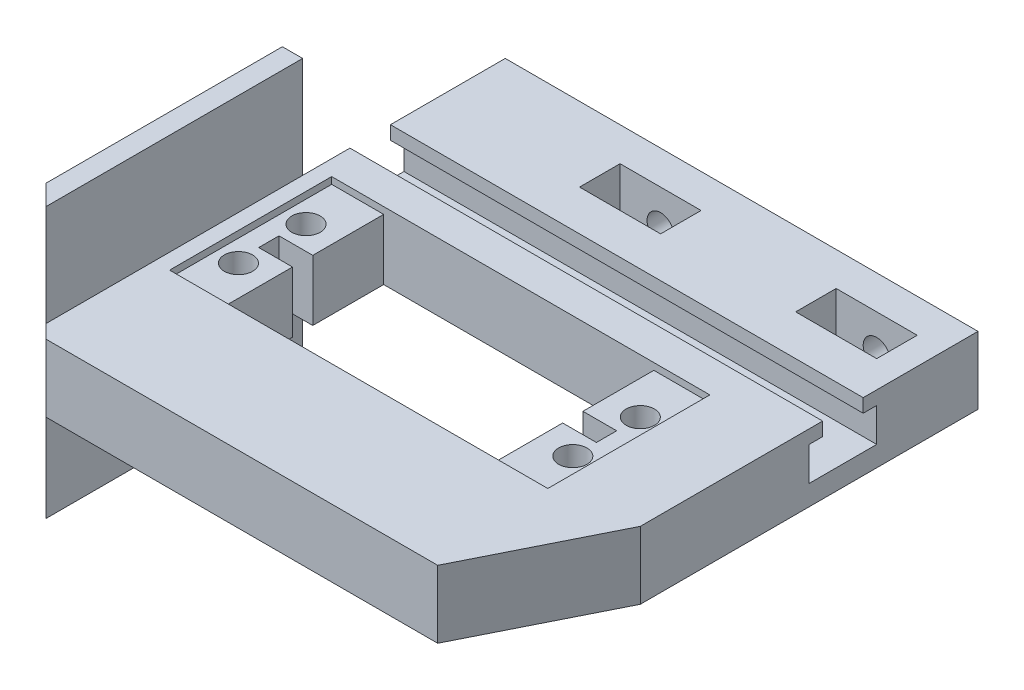
from build123d import *

# Parameters (mm, degrees)
SKETCH_1_W           = 80
SKETCH_1_H           = 60
SKETCH_1_R           = 2.1
SKETCH_1_W_2         = 40
SKETCH_1_H_2         = 24
EXTRUDE_1_DEPTH      = 10
CUT_EXTRUDE_1_DEPTH  = 80
SKETCH_5_W           = 5
SKETCH_5_H           = 3
CUT_EXTRUDE_2_DEPTH  = 80
SKETCH_7_W           = 56
SKETCH_7_H           = 24
CUT_EXTRUDE_3_DEPTH  = 1
SKETCH_8_W           = 40
SKETCH_8_H           = 40
EXTRUDE_2_DEPTH      = 3
SKETCH_9_W           = 10
SKETCH_9_H           = 60
CUT_EXTRUDE_4_DEPTH  = 10
CUT_EXTRUDE_11_DEPTH = 28
CUT_EXTRUDE_12_DEPTH = 28
SKETCH_24_W          = 10
SKETCH_24_H          = 10
EXTRUDE_3_DEPTH      = 70
SKETCH_25_W          = 12
SKETCH_25_H          = 6
CUT_EXTRUDE_13_DEPTH = 9
SKETCH_26_R          = 2
CUT_EXTRUDE_14_DEPTH = 8
CUT_EXTRUDE_15_REACH = 65.828


with BuildPart() as part:
    # 草圖1 → 填料-伸長1 (new body)
    with BuildSketch(Plane(origin=(0, 0, 0), x_dir=(1, 0, 0), z_dir=(0, 1, 0))):
        Rectangle(SKETCH_1_W, SKETCH_1_H)
        with Locations(Location((-34.5, -5, 0), (0, 0, 270))):
            Circle(SKETCH_1_R, mode=Mode.SUBTRACT)
        with Locations(Location((-34.5, 5, 0), (0, 0, 270))):
            Circle(SKETCH_1_R, mode=Mode.SUBTRACT)
        with Locations(Location((15, -5, 0), (0, 0, 270))):
            Circle(SKETCH_1_R, mode=Mode.SUBTRACT)
        with Locations(Location((15, 5, 0), (0, 0, 270))):
            Circle(SKETCH_1_R, mode=Mode.SUBTRACT)
        with Locations((-10, 0)):
            Rectangle(SKETCH_1_W_2, SKETCH_1_H_2, mode=Mode.SUBTRACT)
    extrude(amount=EXTRUDE_1_DEPTH)

    # 草圖4 → 除料-伸長1 (cut)
    with BuildSketch(Plane(origin=(40, 0, 0), x_dir=(0, 0, -1), z_dir=(1, 0, 0))):
        Polygon((17, 10), (17, 8), (15, 8), (15, 3), (25, 3), (25, 8), (23, 8), (23, 10), align=None)
    extrude(amount=-CUT_EXTRUDE_1_DEPTH, mode=Mode.SUBTRACT)

    # 草圖5 → 除料-伸長2 (cut)
    with BuildSketch(Plane(origin=(0, 10, 0), x_dir=(1, 0, 0), z_dir=(0, 1, 0))):
        with Locations((12.5, 0)):
            Rectangle(SKETCH_5_W, SKETCH_5_H)
        with Locations((-32.5, 0)):
            Rectangle(SKETCH_5_W, SKETCH_5_H)
    extrude(amount=-CUT_EXTRUDE_2_DEPTH, mode=Mode.SUBTRACT)

    # 草圖7 → 除料-伸長3 (cut)
    with BuildSketch(Plane(origin=(0, 10, 0), x_dir=(1, 0, 0), z_dir=(0, 1, 0))):
        with Locations((-9.7, 0)):
            Rectangle(SKETCH_7_W, SKETCH_7_H)
    extrude(amount=-CUT_EXTRUDE_3_DEPTH, mode=Mode.SUBTRACT)

    # 草圖8 → 填料-伸長2 (add)
    with BuildSketch(Plane.ZY.offset(40)):
        with Locations((10, 5)):
            Rectangle(SKETCH_8_W, SKETCH_8_H)
    extrude(amount=EXTRUDE_2_DEPTH)

    # 草圖9 → 除料-伸長4 (cut)
    with BuildSketch(Plane(origin=(0, 10, 0), x_dir=(1, 0, 0), z_dir=(0, 1, 0))):
        with Locations((35, 0)):
            Rectangle(SKETCH_9_W, SKETCH_9_H)
    extrude(amount=-CUT_EXTRUDE_4_DEPTH, mode=Mode.SUBTRACT)

    # 草圖22 → 除料-伸長11 (cut)
    with BuildSketch(Plane(origin=(0, 10, 0), x_dir=(1, 0, 0), z_dir=(0, 1, 0))):
        Polygon((-43, -25), (-43, -30), (-38, -30), align=None)
    extrude(amount=-CUT_EXTRUDE_11_DEPTH, mode=Mode.SUBTRACT)

    # 草圖23 → 除料-伸長12 (cut)
    with BuildSketch(Plane(origin=(0, 25, 0), x_dir=(1, 0, 0), z_dir=(0, 1, 0))):
        Polygon((-43, -30), (-38, -30), (-43, -25), align=None)
    extrude(amount=-CUT_EXTRUDE_12_DEPTH, mode=Mode.SUBTRACT)

    # 草圖24 → 填料-伸長3 (add)
    with BuildSketch(Plane.ZY.offset(40)):
        with Locations((-35, 5)):
            Rectangle(SKETCH_24_W, SKETCH_24_H)
    extrude(amount=-EXTRUDE_3_DEPTH)

    # 草圖25 → 除料-伸長13 (cut)
    with BuildSketch(Plane(origin=(0, 10, 0), x_dir=(1, 0, 0), z_dir=(0, 1, 0))):
        with Locations((-12, 32)):
            Rectangle(SKETCH_25_W, SKETCH_25_H)
        with Locations((20, 32)):
            Rectangle(SKETCH_25_W, SKETCH_25_H)
    extrude(amount=-CUT_EXTRUDE_13_DEPTH, mode=Mode.SUBTRACT)

    # 草圖26 → 除料-伸長14 (cut)
    with BuildSketch(Plane(origin=(0, 0, -40), x_dir=(-1, 0, 0), z_dir=(0, 0, -1))):
        with Locations((-20, 4.723394197)):
            Circle(SKETCH_26_R)
        with Locations((12, 4.723394197)):
            Circle(SKETCH_26_R)
    extrude(amount=-CUT_EXTRUDE_14_DEPTH, mode=Mode.SUBTRACT)

    # 草圖27 → 除料-伸長15 (cut, up to next)
    with BuildSketch(Plane(origin=(0, 10, 0), x_dir=(1, 0, 0), z_dir=(0, 1, 0)), mode=Mode.PRIVATE) as cut_extrude_15_sk1:
        Polygon((30, -10), (20, -30), (30, -30), align=None)
    cut_extrude_15_tool1 = extrude(cut_extrude_15_sk1.sketch, amount=-CUT_EXTRUDE_15_REACH, mode=Mode.PRIVATE) & part.part
    add(cut_extrude_15_tool1.solids().sort_by_distance((26.666667, 10, 23.333333))[0], mode=Mode.SUBTRACT)


solid = part.part
